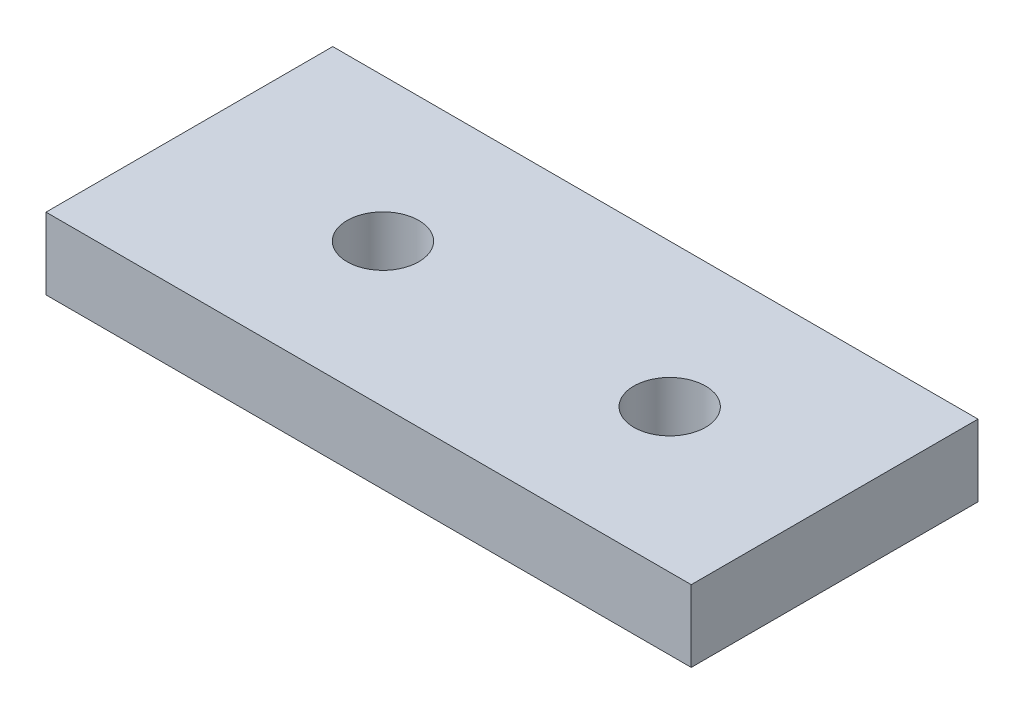
from build123d import *

# Parameters (mm, degrees)
SZKIC1_W                    = 90
SZKIC1_H                    = 40
SZKIC1_R                    = 5
DODANIE_WYCI_GNI_CIE1_DEPTH = 10


with BuildPart() as part:
    # Szkic1 → Dodanie-wyciągnięcie1 (new body)
    with BuildSketch(Plane(origin=(0, 0, 0), x_dir=(1, 0, 0), z_dir=(0, 1, 0))):
        with Locations((45, 20)):
            Rectangle(SZKIC1_W, SZKIC1_H)
        with Locations(Location((27, 20, 0), (0, 0, 270))):
            Circle(SZKIC1_R, mode=Mode.SUBTRACT)
        with Locations(Location((67, 20, 0), (0, 0, 270))):
            Circle(SZKIC1_R, mode=Mode.SUBTRACT)
    extrude(amount=DODANIE_WYCI_GNI_CIE1_DEPTH)


solid = part.part
